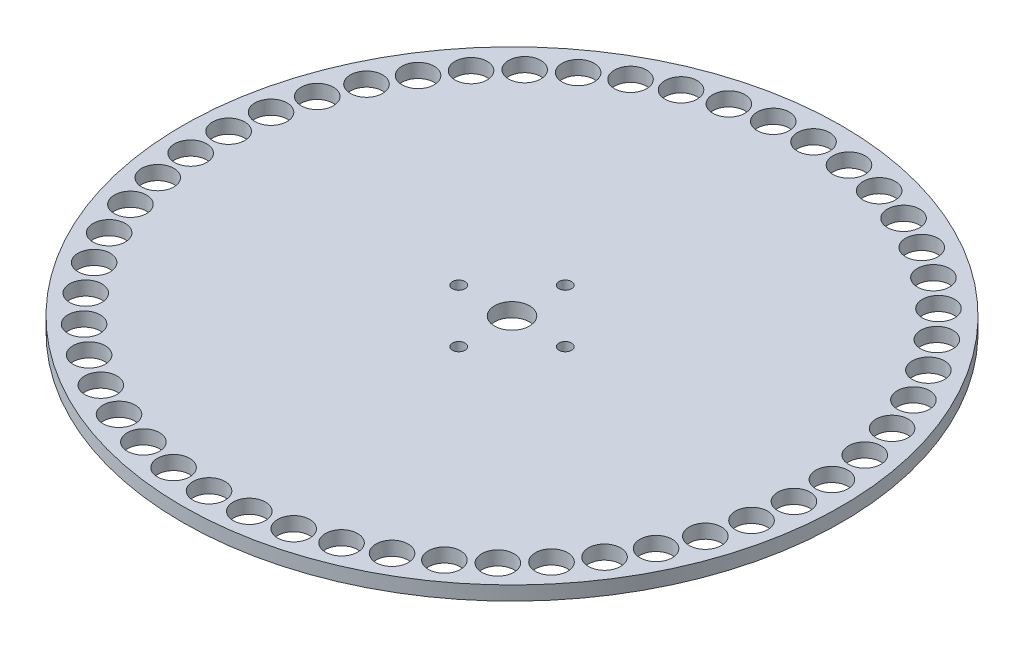
from build123d import *

# Parameters (mm, degrees)
SKETCH1_R           = 117.5
BOSS_EXTRUDE1_DEPTH = 5
SKETCH2_R           = 5.75
CUT_EXTRUDE1_DEPTH  = 167.245300685
CIRPATTERN1_COUNT   = 50
SKETCH3_R           = 6.25
CUT_EXTRUDE2_DEPTH  = 167.245300685
SKETCH4_R           = 2.25
CUT_EXTRUDE3_DEPTH  = 167.245300685
CIRPATTERN2_COUNT   = 4


with BuildPart() as part:
    # Sketch1 → Boss-Extrude1 (new body)
    with BuildSketch(Plane(origin=(0, 0, 0), x_dir=(1, 0, 0), z_dir=(0, 1, 0))):
        with Locations(Location((0, 0, 0), (0, 0, 270))):
            Circle(SKETCH1_R)
    extrude(amount=BOSS_EXTRUDE1_DEPTH)

    # Sketch2 → Cut-Extrude1 (cut, through all)
    with BuildSketch(Plane(origin=(0, 5, 0), x_dir=(1, 0, 0), z_dir=(0, 1, 0))):
        with Locations(Location((0, 107.5, 0), (0, 0, 270))):
            Circle(SKETCH2_R)
    cut_extrude1 = extrude(amount=-CUT_EXTRUDE1_DEPTH, mode=Mode.SUBTRACT)

    # CirPattern1: Cut-Extrude1 ×50 about axis
    cirpattern1_axis = Axis((0, 0, 0.258053464), (0, 1, 0))
    for i in range(1, CIRPATTERN1_COUNT):
        add(cut_extrude1.rotate(cirpattern1_axis, i * 360 / CIRPATTERN1_COUNT), mode=Mode.SUBTRACT)

    # Sketch3 → Cut-Extrude2 (cut, through all)
    with BuildSketch(Plane(origin=(0, 5, 0), x_dir=(1, 0, 0), z_dir=(0, 1, 0))):
        with Locations(Location((0, 0, 0), (0, 0, 270))):
            Circle(SKETCH3_R)
    extrude(amount=-CUT_EXTRUDE2_DEPTH, mode=Mode.SUBTRACT)

    # Sketch4 → Cut-Extrude3 (cut, through all)
    with BuildSketch(Plane(origin=(0, 5, 0), x_dir=(1, 0, 0), z_dir=(0, 1, 0))):
        with Locations(Location((19, 0, 0), (0, 0, 270))):
            Circle(SKETCH4_R)
    cut_extrude3 = extrude(amount=-CUT_EXTRUDE3_DEPTH, mode=Mode.SUBTRACT)

    # CirPattern2: Cut-Extrude3 ×4 about axis
    cirpattern2_axis = Axis((0, 0, 0), (0, 1, 0))
    for i in range(1, CIRPATTERN2_COUNT):
        add(cut_extrude3.rotate(cirpattern2_axis, i * 360 / CIRPATTERN2_COUNT), mode=Mode.SUBTRACT)


solid = part.part
